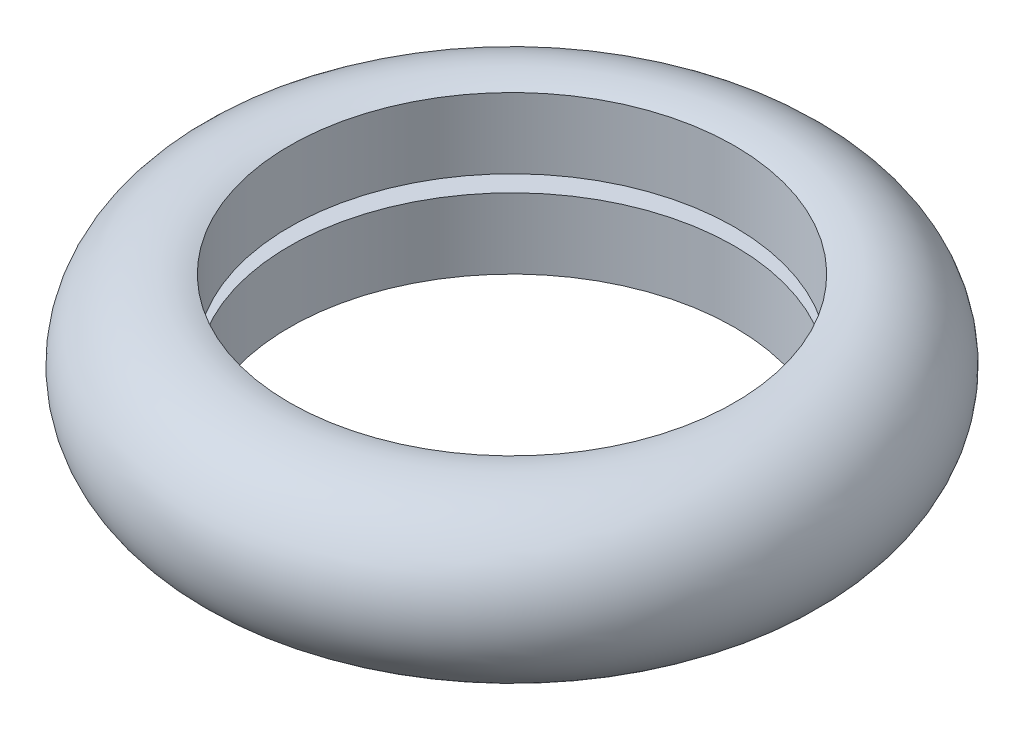
from build123d import *


with BuildPart() as part:
    # Sketch1 → Revolve1 (revolve)
    with BuildSketch(Plane.XY, mode=Mode.PRIVATE) as revolve1_sk:
        with BuildLine():
            ThreePointArc((-40.5, 14.309088021), (-60, 0), (-40.5, -14.309088021))
            Line((-40.5, -14.309088021), (-40.5, -1.5))
            Line((-40.5, -1.5), (-46.5, -1.5))
            Line((-46.5, -1.5), (-46.5, 1.5))
            Line((-46.5, 1.5), (-40.5, 1.5))
            Line((-40.5, 1.5), (-40.5, 14.309088021))
        make_face()
    revolve(revolve1_sk.sketch.rotate(Axis((0, 0, 0), (0, -1, 0)), 270), axis=Axis((0, 0, 0), (0, -1, 0)))


solid = part.part
